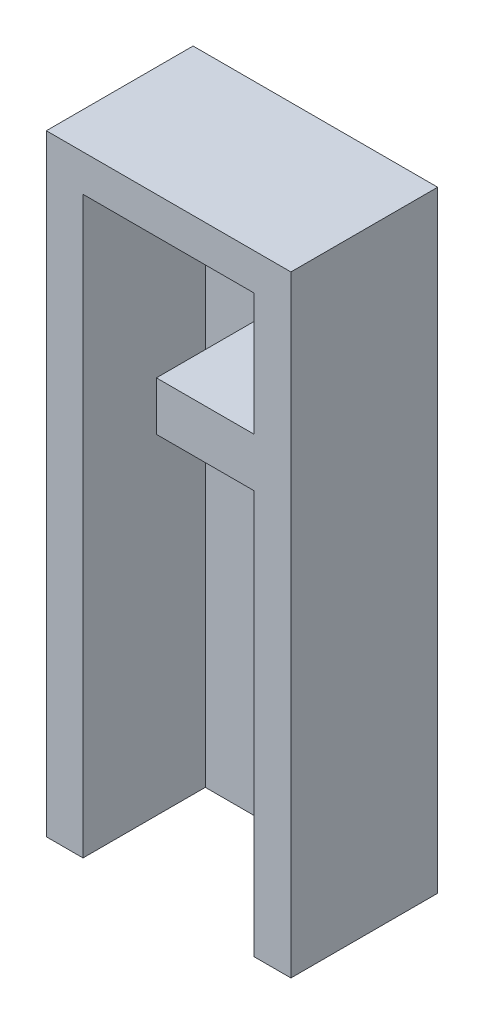
from build123d import *

# Parameters (mm, degrees)
SKETCH1_W           = 10
SKETCH1_H           = 25
BOSS_EXTRUDE1_DEPTH = 5
SKETCH2_W           = 10
SKETCH2_H           = 25
BOSS_EXTRUDE2_DEPTH = 1
SKETCH3_W           = 7
SKETCH3_H           = 5
CUT_EXTRUDE1_DEPTH  = 5


with BuildPart() as part:
    # Sketch1 → Boss-Extrude1 (new body)
    with BuildSketch(Plane.XY):
        with Locations((3.5, 11)):
            Rectangle(SKETCH1_W, SKETCH1_H)
        Polygon((7, 17), (3, 17), (3, 15), (7, 15), (7, 0), (0, 0), (0, 22), (7, 22), align=None, mode=Mode.SUBTRACT)
    extrude(amount=BOSS_EXTRUDE1_DEPTH)

    # Sketch2 → Boss-Extrude2 (add)
    with BuildSketch(Plane(origin=(0, 0, 0), x_dir=(-1, 0, 0), z_dir=(0, 0, -1))):
        with Locations((-3.5, 11)):
            Rectangle(SKETCH2_W, SKETCH2_H)
    extrude(amount=BOSS_EXTRUDE2_DEPTH)

    # Sketch3 → Cut-Extrude1 (cut)
    with BuildSketch(Plane(origin=(0, 0, 0), x_dir=(1, 0, 0), z_dir=(0, 1, 0))):
        with Locations((3.5, -2.5)):
            Rectangle(SKETCH3_W, SKETCH3_H)
    extrude(amount=-CUT_EXTRUDE1_DEPTH, mode=Mode.SUBTRACT)


solid = part.part
